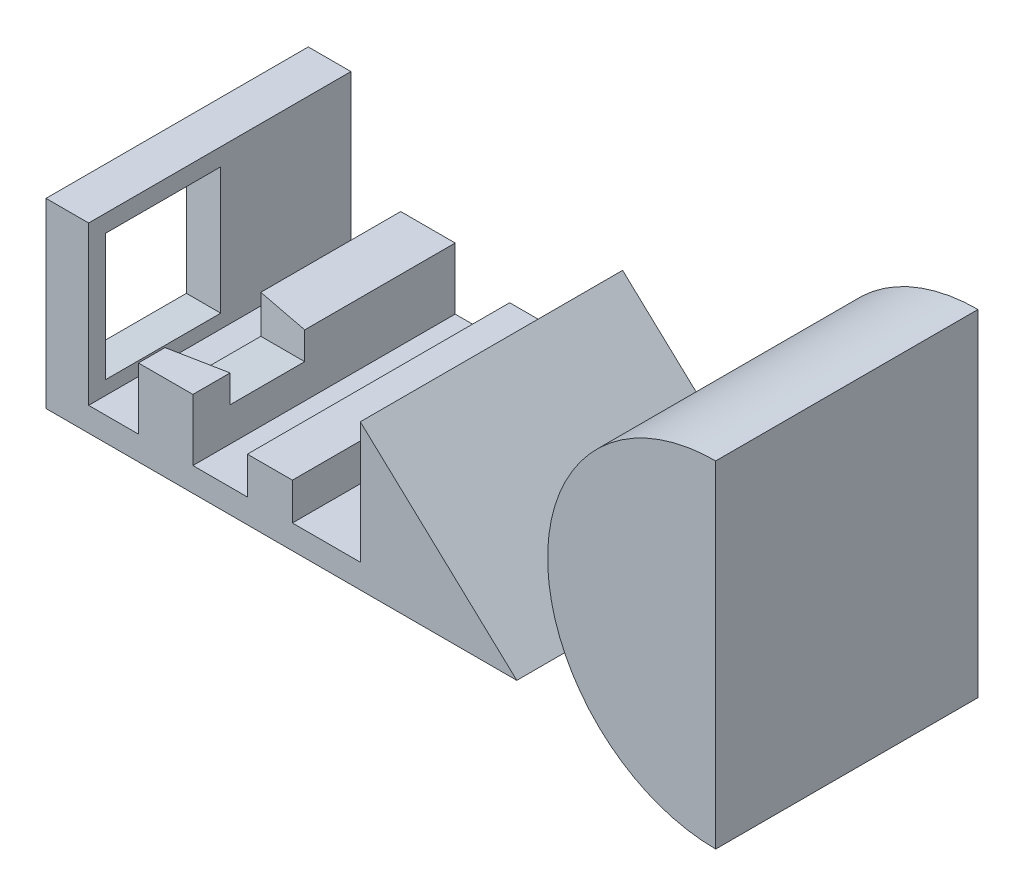
from build123d import *

# Parameters (mm, degrees)
BOSS_EXTRUDE1_DEPTH   = 190.5
BOSS_EXTRUDE1_2_DEPTH = 190.5
SKETCH2_W             = 191.334958583
SKETCH2_H             = 208.232071809
CUT_EXTRUDE1_DEPTH    = 254
CUT_EXTRUDE1_DRAFT    = -11


with BuildPart() as part:
    # Sketch1 → Boss-Extrude1 (new, symmetric)
    with BuildSketch(Plane.XY):
        Polygon((0, 0), (0, 264.438275148), (61.950832356, 264.438275148), (61.950832356, 34.990747905), (134.226803438, 34.990747905), (134.226803438, 124.47528353), (213.386200337, 124.47528353), (213.386200337, 34.990747905), (292.545597236, 34.990747905), (292.545597236, 88.910916807), (357.9381425, 88.910916807), (357.9381425, 34.990747905), (456.600579215, 34.990747905), (456.600579215, 211.665343882), (683.937189208, 0), align=None)
    extrude(amount=BOSS_EXTRUDE1_DEPTH, both=True)


with BuildPart() as body_2:
    # Sketch1 → Boss-Extrude1 2 (new, symmetric)
    with BuildSketch(Plane.XY):
        with BuildLine():
            Line((972.879836168, 420.603130604), (972.879836168, -67.762908332))
            ThreePointArc((972.879836168, -67.762908332), (728.696816701, 176.420111136), (972.879836168, 420.603130604))
        make_face()
    extrude(amount=BOSS_EXTRUDE1_2_DEPTH, both=True)


with BuildPart() as cut_extrude1_tool:
    # Sketch2 → Cut-Extrude1 (with draft: the straight prism first)
    with BuildSketch(Plane.ZY):
        with Locations((82.249183495, 147.098649951)):
            Rectangle(SKETCH2_W, SKETCH2_H)
    extrude(amount=-CUT_EXTRUDE1_DEPTH)
    # Cut-Extrude1: the draft: its side faces are tilted about the plane it starts from
    cut_extrude1_sides = [cut_extrude1_tool.faces().sort_by_distance(p)[0] for p in [
        (127, 147.098649951, -13.418295797),
        (127, 42.982614046, 82.249183495),
        (127, 147.098649951, 177.916662786),
        (127, 251.214685855, 82.249183495),
    ]]
    draft(cut_extrude1_sides, Plane.ZY, CUT_EXTRUDE1_DRAFT)


with BuildPart() as part_1:
    add(part.part)

    # Cut-Extrude1: cut by cut_extrude1_tool
    add(cut_extrude1_tool.part, mode=Mode.SUBTRACT)


solid = Compound([body_2.part, part_1.part])
